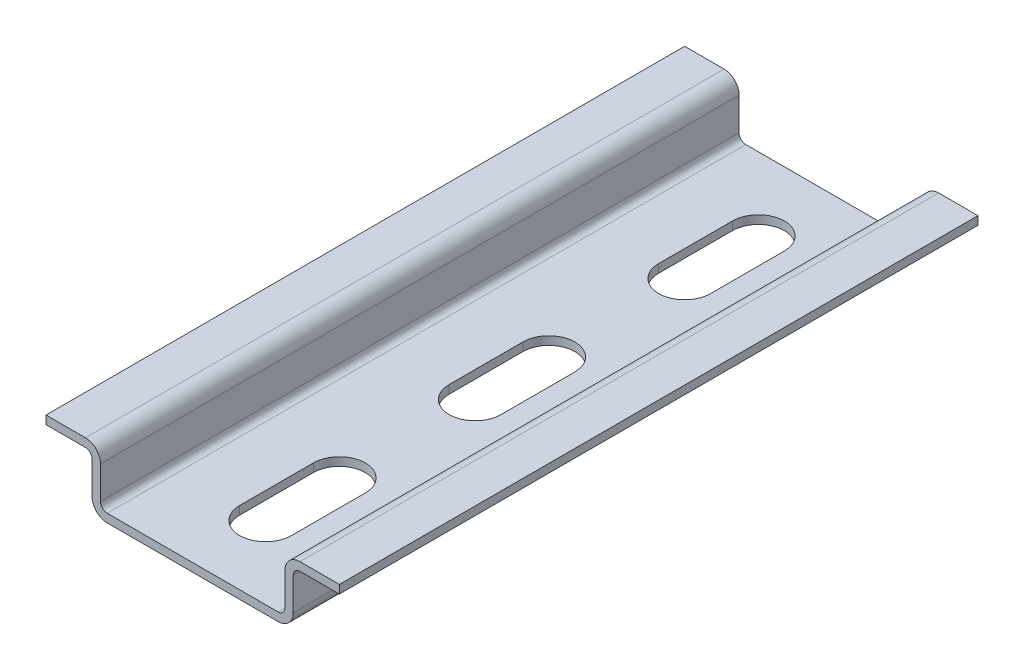
from build123d import *

# Parameters (mm, degrees)
BASE_EXTRUDE_THIN_DEPTH = 254
FILLET1_R               = 0.8
FILLET2_R               = 1.8
CUT_EXTRUDE1_DEPTH      = 255.685099682
LPATTERN1_COUNT         = 10
LPATTERN1_PITCH         = 25
MIRROR1_COPY_1_DEPTH    = 255.685099682
MIRROR1_COPY_2_DEPTH    = 255.685099682
MIRROR1_COPY_3_DEPTH    = 255.685099682
MIRROR1_COPY_4_DEPTH    = 255.685099682
MIRROR1_COPY_5_DEPTH    = 255.685099682
MIRROR1_COPY_6_DEPTH    = 255.685099682
MIRROR1_COPY_7_DEPTH    = 255.685099682
MIRROR1_COPY_8_DEPTH    = 255.685099682
MIRROR1_COPY_9_DEPTH    = 255.685099682
MIRROR1_COPY_10_DEPTH   = 255.685099682
SKETCH3_OUTSIDE_W       = 138.852
SKETCH3_OUTSIDE_H       = 611.852
SKETCH3_OUTSIDE_W_2     = 99.454563768
SKETCH3_OUTSIDE_H_2     = 76.2
CUT_EXTRUDE2_3_DEPTH    = 255.712583121


with BuildPart() as part:
    # Sketch1 → Base-Extrude-Thin (new, symmetric)
    with BuildSketch(Plane.XY):
        Polygon((-17.5, 6.5), (-12, 6.5), (-12, 0), (12, 0), (12, 6.5), (17.5, 6.5), (17.5, 7.5), (11, 7.5), (11, 1), (-11, 1), (-11, 7.5), (-17.5, 7.5), align=None)
    extrude(amount=BASE_EXTRUDE_THIN_DEPTH, both=True)

    # Fillet1
    fillet1_edges = [part.edges().sort_by_distance(p)[0] for p in [
        (-11, 1, 0),
        (11, 1, 0),
        (12, 6.5, 0),
        (-12, 6.5, 0),
    ]]
    fillet(fillet1_edges, radius=FILLET1_R)

    # Fillet2
    fillet2_edges = [part.edges().sort_by_distance(p)[0] for p in [
        (-11, 7.5, 0),
        (11, 7.5, 0),
        (12, 0, 0),
        (-12, 0, 0),
    ]]
    fillet(fillet2_edges, radius=FILLET2_R)

    # Sketch2 → Cut-Extrude1 (cut, through all)
    with BuildSketch(Plane(origin=(0, 1, 0), x_dir=(-1, 0, 0), z_dir=(0, 1, 0))):
        with BuildLine():
            Line((3.1, 4.4), (3.1, -4.4))
            ThreePointArc((3.1, -4.4), (0, -7.5), (-3.1, -4.4))
            Line((-3.1, -4.4), (-3.1, 4.4))
            ThreePointArc((-3.1, 4.4), (0, 7.5), (3.1, 4.4))
        make_face()
    cut_extrude1 = extrude(amount=-CUT_EXTRUDE1_DEPTH, mode=Mode.SUBTRACT)

    # LPattern1: Cut-Extrude1 ×10
    with Locations(*[(0, 0, -i * LPATTERN1_PITCH) for i in range(1, LPATTERN1_COUNT)]):
        add(cut_extrude1, mode=Mode.SUBTRACT)

    # Mirror1 copy 1 sketch → Mirror1 copy 1 (cut, through all)
    with BuildSketch(Plane(origin=(0, 1, 25), x_dir=(-1, 0, 0), z_dir=(0, 1, 0))):
        with BuildLine():
            Line((3.1, -4.4), (3.1, 4.4))
            ThreePointArc((3.1, 4.4), (0, 7.5), (-3.1, 4.4))
            Line((-3.1, 4.4), (-3.1, -4.4))
            ThreePointArc((-3.1, -4.4), (0, -7.5), (3.1, -4.4))
        make_face()
    extrude(amount=-MIRROR1_COPY_1_DEPTH, mode=Mode.SUBTRACT)

    # Mirror1 copy 2 sketch → Mirror1 copy 2 (cut, through all)
    with BuildSketch(Plane(origin=(0, 1, 50), x_dir=(-1, 0, 0), z_dir=(0, 1, 0))):
        with BuildLine():
            Line((3.1, -4.4), (3.1, 4.4))
            ThreePointArc((3.1, 4.4), (0, 7.5), (-3.1, 4.4))
            Line((-3.1, 4.4), (-3.1, -4.4))
            ThreePointArc((-3.1, -4.4), (0, -7.5), (3.1, -4.4))
        make_face()
    extrude(amount=-MIRROR1_COPY_2_DEPTH, mode=Mode.SUBTRACT)

    # Mirror1 copy 3 sketch → Mirror1 copy 3 (cut, through all)
    with BuildSketch(Plane(origin=(0, 1, 75), x_dir=(-1, 0, 0), z_dir=(0, 1, 0))):
        with BuildLine():
            Line((3.1, -4.4), (3.1, 4.4))
            ThreePointArc((3.1, 4.4), (0, 7.5), (-3.1, 4.4))
            Line((-3.1, 4.4), (-3.1, -4.4))
            ThreePointArc((-3.1, -4.4), (0, -7.5), (3.1, -4.4))
        make_face()
    extrude(amount=-MIRROR1_COPY_3_DEPTH, mode=Mode.SUBTRACT)

    # Mirror1 copy 4 sketch → Mirror1 copy 4 (cut, through all)
    with BuildSketch(Plane(origin=(0, 1, 100), x_dir=(-1, 0, 0), z_dir=(0, 1, 0))):
        with BuildLine():
            Line((3.1, -4.4), (3.1, 4.4))
            ThreePointArc((3.1, 4.4), (0, 7.5), (-3.1, 4.4))
            Line((-3.1, 4.4), (-3.1, -4.4))
            ThreePointArc((-3.1, -4.4), (0, -7.5), (3.1, -4.4))
        make_face()
    extrude(amount=-MIRROR1_COPY_4_DEPTH, mode=Mode.SUBTRACT)

    # Mirror1 copy 5 sketch → Mirror1 copy 5 (cut, through all)
    with BuildSketch(Plane(origin=(0, 1, 125), x_dir=(-1, 0, 0), z_dir=(0, 1, 0))):
        with BuildLine():
            Line((3.1, -4.4), (3.1, 4.4))
            ThreePointArc((3.1, 4.4), (0, 7.5), (-3.1, 4.4))
            Line((-3.1, 4.4), (-3.1, -4.4))
            ThreePointArc((-3.1, -4.4), (0, -7.5), (3.1, -4.4))
        make_face()
    extrude(amount=-MIRROR1_COPY_5_DEPTH, mode=Mode.SUBTRACT)

    # Mirror1 copy 6 sketch → Mirror1 copy 6 (cut, through all)
    with BuildSketch(Plane(origin=(0, 1, 150), x_dir=(-1, 0, 0), z_dir=(0, 1, 0))):
        with BuildLine():
            Line((3.1, -4.4), (3.1, 4.4))
            ThreePointArc((3.1, 4.4), (0, 7.5), (-3.1, 4.4))
            Line((-3.1, 4.4), (-3.1, -4.4))
            ThreePointArc((-3.1, -4.4), (0, -7.5), (3.1, -4.4))
        make_face()
    extrude(amount=-MIRROR1_COPY_6_DEPTH, mode=Mode.SUBTRACT)

    # Mirror1 copy 7 sketch → Mirror1 copy 7 (cut, through all)
    with BuildSketch(Plane(origin=(0, 1, 175), x_dir=(-1, 0, 0), z_dir=(0, 1, 0))):
        with BuildLine():
            Line((3.1, -4.4), (3.1, 4.4))
            ThreePointArc((3.1, 4.4), (0, 7.5), (-3.1, 4.4))
            Line((-3.1, 4.4), (-3.1, -4.4))
            ThreePointArc((-3.1, -4.4), (0, -7.5), (3.1, -4.4))
        make_face()
    extrude(amount=-MIRROR1_COPY_7_DEPTH, mode=Mode.SUBTRACT)

    # Mirror1 copy 8 sketch → Mirror1 copy 8 (cut, through all)
    with BuildSketch(Plane(origin=(0, 1, 200), x_dir=(-1, 0, 0), z_dir=(0, 1, 0))):
        with BuildLine():
            Line((3.1, -4.4), (3.1, 4.4))
            ThreePointArc((3.1, 4.4), (0, 7.5), (-3.1, 4.4))
            Line((-3.1, 4.4), (-3.1, -4.4))
            ThreePointArc((-3.1, -4.4), (0, -7.5), (3.1, -4.4))
        make_face()
    extrude(amount=-MIRROR1_COPY_8_DEPTH, mode=Mode.SUBTRACT)

    # Mirror1 copy 9 sketch → Mirror1 copy 9 (cut, through all)
    with BuildSketch(Plane(origin=(0, 1, 225), x_dir=(-1, 0, 0), z_dir=(0, 1, 0))):
        with BuildLine():
            Line((3.1, -4.4), (3.1, 4.4))
            ThreePointArc((3.1, 4.4), (0, 7.5), (-3.1, 4.4))
            Line((-3.1, 4.4), (-3.1, -4.4))
            ThreePointArc((-3.1, -4.4), (0, -7.5), (3.1, -4.4))
        make_face()
    extrude(amount=-MIRROR1_COPY_9_DEPTH, mode=Mode.SUBTRACT)

    # Mirror1 copy 10 sketch → Mirror1 copy 10 (cut, through all)
    with BuildSketch(Plane(origin=(0, 1, 0), x_dir=(-1, 0, 0), z_dir=(0, 1, 0))):
        with BuildLine():
            Line((3.1, -4.4), (3.1, 4.4))
            ThreePointArc((3.1, 4.4), (0, 7.5), (-3.1, 4.4))
            Line((-3.1, 4.4), (-3.1, -4.4))
            ThreePointArc((-3.1, -4.4), (0, -7.5), (3.1, -4.4))
        make_face()
    extrude(amount=-MIRROR1_COPY_10_DEPTH, mode=Mode.SUBTRACT)

    # Sketch3 outside → Cut-Extrude2 (3") (cut, through all)
    with BuildSketch(Plane(origin=(0, 7.5, 0), x_dir=(-1, 0, 0), z_dir=(0, 1, 0))):
        Rectangle(SKETCH3_OUTSIDE_W, SKETCH3_OUTSIDE_H)
        with Locations((-1.499324946, 0)):
            Rectangle(SKETCH3_OUTSIDE_W_2, SKETCH3_OUTSIDE_H_2, mode=Mode.SUBTRACT)
    extrude(amount=-CUT_EXTRUDE2_3_DEPTH, mode=Mode.SUBTRACT)


solid = part.part
